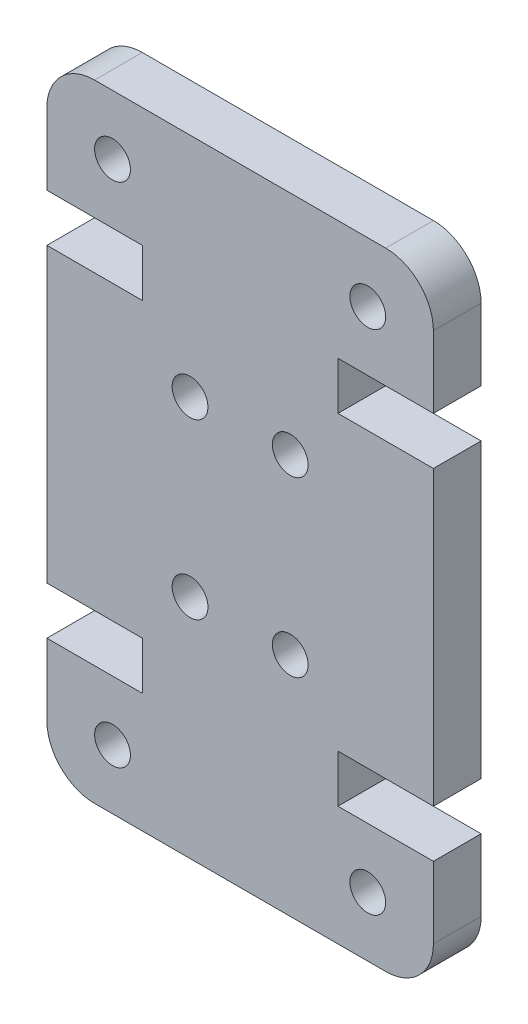
from build123d import *

# Parameters (mm, degrees)
SKETCH2_R           = 0.75
BOSS_EXTRUDE1_DEPTH = 2


with BuildPart() as part:
    # Sketch2 → Boss-Extrude1 (new body)
    with BuildSketch(Plane.XY):
        with BuildLine():
            Line((0, 7), (0, 19.26))
            Line((0, 19.26), (4, 19.26))
            Line((4, 19.26), (4, 21.26))
            Line((4, 21.26), (0, 21.26))
            Line((0, 21.26), (0, 24.26))
            ThreePointArc((0, 24.26), (0.585786438, 25.674213562), (2, 26.26))
            Line((2, 26.26), (14.2, 26.26))
            ThreePointArc((14.2, 26.26), (15.614213562, 25.674213562), (16.2, 24.26))
            Line((16.2, 24.26), (16.2, 21.26))
            Line((16.2, 21.26), (12.2, 21.26))
            Line((12.2, 21.26), (12.2, 19.26))
            Line((12.2, 19.26), (16.2, 19.26))
            Line((16.2, 19.26), (16.2, 7))
            Line((16.2, 7), (12.2, 7))
            Line((12.2, 7), (12.2, 5))
            Line((12.2, 5), (16.2, 5))
            Line((16.2, 5), (16.2, 2))
            ThreePointArc((16.2, 2), (15.614213562, 0.585786438), (14.2, 0))
            Line((14.2, 0), (2, 0))
            ThreePointArc((2, 0), (0.585786438, 0.585786438), (0, 2))
            Line((0, 2), (0, 5))
            Line((0, 5), (4, 5))
            Line((4, 5), (4, 7))
            Line((4, 7), (0, 7))
        make_face()
        with Locations(Location((13.45, 2.5, 0), (0, 0, 180))):
            Circle(SKETCH2_R, mode=Mode.SUBTRACT)
        with Locations(Location((10.2, 9.5, 0), (0, 0, 180))):
            Circle(SKETCH2_R, mode=Mode.SUBTRACT)
        with Locations(Location((2.75, 23.76, 0), (0, 0, 180))):
            Circle(SKETCH2_R, mode=Mode.SUBTRACT)
        with Locations(Location((6, 16.76, 0), (0, 0, 180))):
            Circle(SKETCH2_R, mode=Mode.SUBTRACT)
        with Locations((10.2, 16.76)):
            Circle(SKETCH2_R, mode=Mode.SUBTRACT)
        with Locations((13.45, 23.76)):
            Circle(SKETCH2_R, mode=Mode.SUBTRACT)
        with Locations((6, 9.5)):
            Circle(SKETCH2_R, mode=Mode.SUBTRACT)
        with Locations((2.75, 2.5)):
            Circle(SKETCH2_R, mode=Mode.SUBTRACT)
    extrude(amount=BOSS_EXTRUDE1_DEPTH)


solid = part.part
